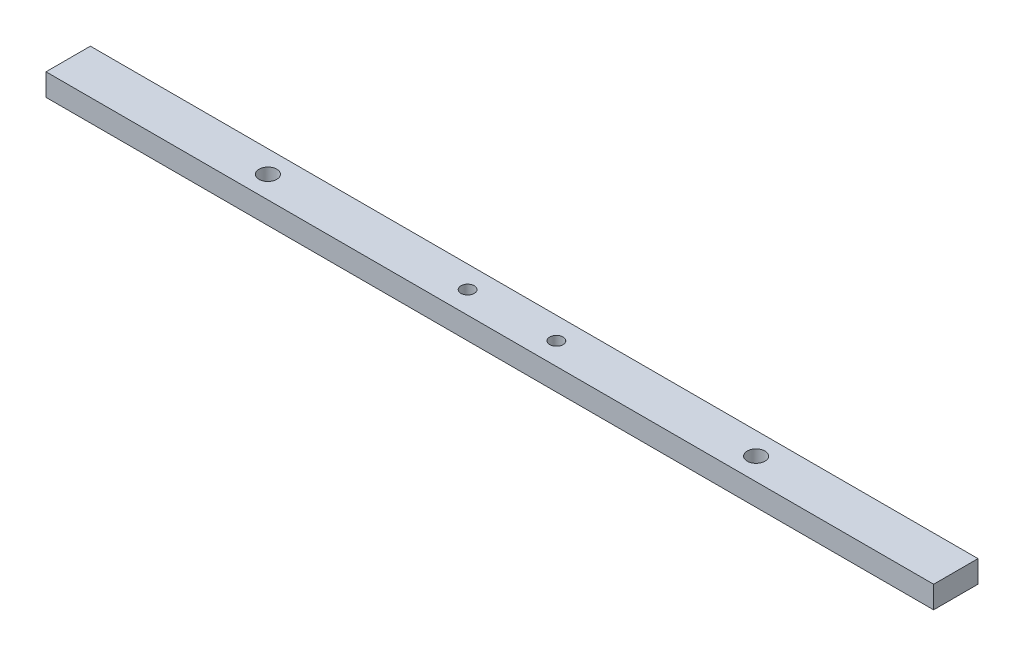
from build123d import *

# Parameters (mm, degrees)
ESQUISSE1_W             = 200
ESQUISSE1_H             = 5
BOSS_EXTRU_1_DEPTH      = 10
ESQUISSE3_R             = 2
ENL_V_MAT_EXTRU_1_DEPTH = 10
ESQUISSE3_4_R           = 2
ESQUISSE3_4_R_2         = 1.5
ENL_V_MAT_EXTRU_2_DEPTH = 10


with BuildPart() as part:
    # Esquisse1 → Boss.-Extru.1 (new body)
    with BuildSketch(Plane.XY):
        with Locations((100, -2.5)):
            Rectangle(ESQUISSE1_W, ESQUISSE1_H)
    extrude(amount=BOSS_EXTRU_1_DEPTH)

    # Esquisse3 → Enlèv. mat.-Extru.1 (cut)
    with BuildSketch(Plane.XZ.offset(5)):
        with Locations((45, 5)):
            Circle(ESQUISSE3_R)
    extrude(amount=-ENL_V_MAT_EXTRU_1_DEPTH, mode=Mode.SUBTRACT)

    # Esquisse3<4> → Enlèv. mat.-Extru.2 (cut)
    with BuildSketch(Plane.XZ.offset(5)):
        with Locations((45, 5)):
            Circle(ESQUISSE3_4_R)
        with Locations((155, 5)):
            Circle(ESQUISSE3_4_R)
        with Locations((110, 5)):
            Circle(ESQUISSE3_4_R_2)
        with Locations((90, 5)):
            Circle(ESQUISSE3_4_R_2)
    extrude(amount=-ENL_V_MAT_EXTRU_2_DEPTH, mode=Mode.SUBTRACT)


solid = part.part
